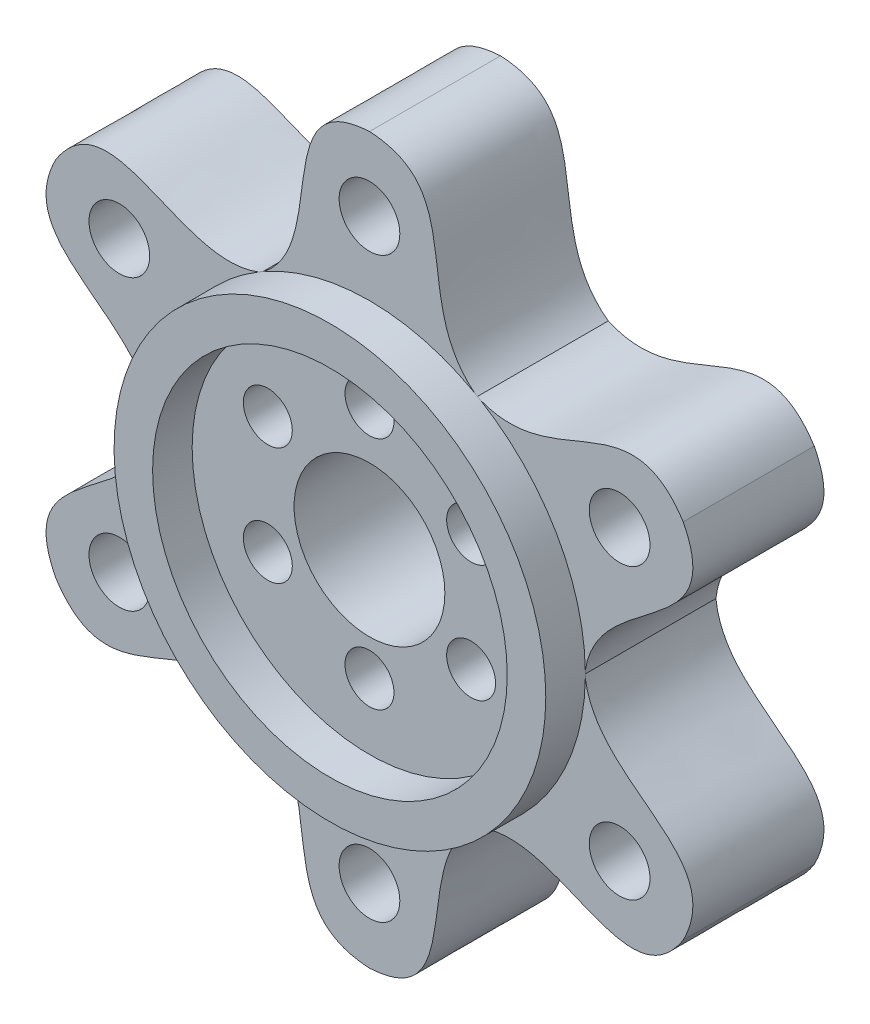
from build123d import *

# Parameters (mm, degrees)
SKETCH1_R           = 46.99
SKETCH1_R_2         = 9.779
SKETCH1_R_3         = 3.175
SKETCH1_R_4         = 3.937
BOSS_EXTRUDE3_DEPTH = 17.000000036
CUT_EXTRUDE1_START  = -22.86
CUT_EXTRUDE1_DEPTH  = 22.86
SKETCH4_R           = 28
SKETCH4_R_2         = 23
BOSS_EXTRUDE4_DEPTH = 5.1308


with BuildPart() as part:
    # Sketch1 → Boss-Extrude3 (new body)
    with BuildSketch(Plane.XY):
        Circle(SKETCH1_R)
        Circle(SKETCH1_R_2, mode=Mode.SUBTRACT)
        with Locations((0, 16.002)):
            Circle(SKETCH1_R_3, mode=Mode.SUBTRACT)
        with Locations((13.184862266, 8.389716222)):
            Circle(SKETCH1_R_3, mode=Mode.SUBTRACT)
        with Locations((13.184862266, -6.834851335)):
            Circle(SKETCH1_R_3, mode=Mode.SUBTRACT)
        with Locations((0, -14.447135113)):
            Circle(SKETCH1_R_3, mode=Mode.SUBTRACT)
        with Locations((-13.184862266, -6.834851335)):
            Circle(SKETCH1_R_3, mode=Mode.SUBTRACT)
        with Locations((-13.184862266, 8.389716222)):
            Circle(SKETCH1_R_3, mode=Mode.SUBTRACT)
        with Locations((0, 37.465)):
            Circle(SKETCH1_R_4, mode=Mode.SUBTRACT)
        with Locations((32.445641753, 18.7325)):
            Circle(SKETCH1_R_4, mode=Mode.SUBTRACT)
        with Locations((32.445641753, -18.7325)):
            Circle(SKETCH1_R_4, mode=Mode.SUBTRACT)
        with Locations((0, -37.465)):
            Circle(SKETCH1_R_4, mode=Mode.SUBTRACT)
        with Locations((-32.445641753, -18.7325)):
            Circle(SKETCH1_R_4, mode=Mode.SUBTRACT)
        with Locations((-32.445641753, 18.7325)):
            Circle(SKETCH1_R_4, mode=Mode.SUBTRACT)
    extrude(amount=BOSS_EXTRUDE3_DEPTH)

    # Sketch2 → Cut-Extrude1 (cut)
    with BuildSketch(Plane.XY.offset(17.000000036).offset(CUT_EXTRUDE1_START)):
        with BuildLine():
            add(Edge.make_bspline(
                [(13.97, 24.196749782), (24.267548566, 19.662066064), (33.464346328, 34.617796024), (40.694533724, 23.495)],
                knots=[0, 0, 0, 0, 1, 1, 1, 1], degree=3))
            ThreePointArc((40.694533724, 23.495), (23.495, 40.694533724), (0, 46.99))
            add(Edge.make_bspline(
                [(13.97, 24.196749782), (4.894074419, 30.847346578), (13.247717616, 46.289872053), (0, 46.99)],
                knots=[0, 0, 0, 0, 1, 1, 1, 1], degree=3))
        make_face()
        with BuildLine():
            add(Edge.make_bspline(
                [(-27.94, 0), (-29.161622986, 11.185280514), (-46.712063944, 11.672076029), (-40.694533724, 23.495)],
                knots=[0, 0, 0, 0, 1, 1, 1, 1], degree=3))
            ThreePointArc((-40.694533724, 23.495), (-46.99, 0), (-40.694533724, -23.495))
            add(Edge.make_bspline(
                [(-27.94, 0), (-29.161622986, -11.185280514), (-46.712063944, -11.672076029), (-40.694533724, -23.495)],
                knots=[0, 0, 0, 0, 1, 1, 1, 1], degree=3))
        make_face()
        with BuildLine():
            ThreePointArc((40.694533724, -23.495), (45.388854577, -12.161906929), (46.99, 0))
            ThreePointArc((46.99, 0), (45.388854577, 12.161906929), (40.694533724, 23.495))
            add(Edge.make_bspline(
                [(27.94, 0), (29.161622986, 11.185280514), (46.712063944, 11.672076029), (40.694533724, 23.495)],
                knots=[0, 0, 0, 0, 1, 1, 1, 1], degree=3))
            add(Edge.make_bspline(
                [(27.94, 0), (29.161622986, -11.185280514), (46.712063944, -11.672076029), (40.694533724, -23.495)],
                knots=[0, 0, 0, 0, 1, 1, 1, 1], degree=3))
        make_face()
        with BuildLine():
            ThreePointArc((0, -46.99), (23.495, -40.694533724), (40.694533724, -23.495))
            add(Edge.make_bspline(
                [(13.97, -24.196749782), (24.267548566, -19.662066064), (33.464346328, -34.617796024), (40.694533724, -23.495)],
                knots=[0, 0, 0, 0, 1, 1, 1, 1], degree=3))
            add(Edge.make_bspline(
                [(13.97, -24.196749782), (4.894074419, -30.847346578), (13.247717616, -46.289872053), (0, -46.99)],
                knots=[0, 0, 0, 0, 1, 1, 1, 1], degree=3))
        make_face()
        with BuildLine():
            ThreePointArc((-40.694533724, -23.495), (-23.495, -40.694533724), (0, -46.99))
            add(Edge.make_bspline(
                [(-13.97, -24.196749782), (-4.894074419, -30.847346578), (-13.247717616, -46.289872053), (0, -46.99)],
                knots=[0, 0, 0, 0, 1, 1, 1, 1], degree=3))
            add(Edge.make_bspline(
                [(-13.97, -24.196749782), (-24.267548566, -19.662066064), (-33.464346328, -34.617796024), (-40.694533724, -23.495)],
                knots=[0, 0, 0, 0, 1, 1, 1, 1], degree=3))
        make_face()
        with BuildLine():
            add(Edge.make_bspline(
                [(-13.97, 24.196749782), (-4.894074419, 30.847346578), (-13.247717616, 46.289872053), (0, 46.99)],
                knots=[0, 0, 0, 0, 1, 1, 1, 1], degree=3))
            ThreePointArc((0, 46.99), (-23.495, 40.694533724), (-40.694533724, 23.495))
            add(Edge.make_bspline(
                [(-13.97, 24.196749782), (-24.267548566, 19.662066064), (-33.464346328, 34.617796024), (-40.694533724, 23.495)],
                knots=[0, 0, 0, 0, 1, 1, 1, 1], degree=3))
        make_face()
    extrude(amount=CUT_EXTRUDE1_DEPTH, mode=Mode.SUBTRACT)

    # Sketch4 → Boss-Extrude4 (add)
    with BuildSketch(Plane.XY.offset(17.000000036)):
        with Locations(Location((0, 0, 0), (0, 0, 180.892161373))):
            Circle(SKETCH4_R)
        Circle(SKETCH4_R_2, mode=Mode.SUBTRACT)
    extrude(amount=BOSS_EXTRUDE4_DEPTH)


solid = part.part
